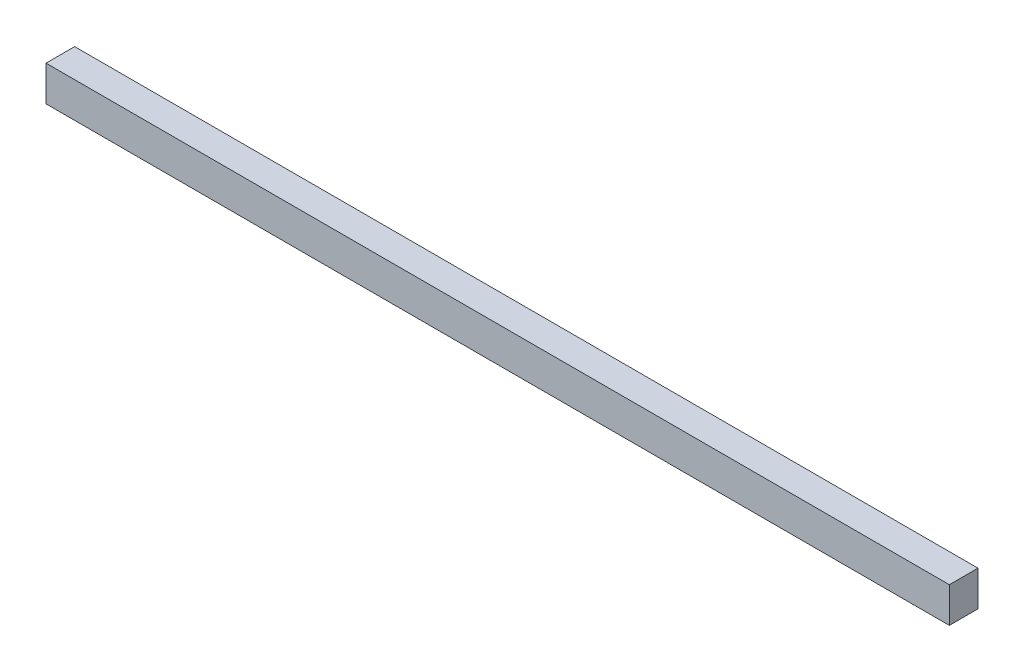
from build123d import *

# Parameters (mm, degrees)
SKETCH1_W           = 410
SKETCH1_H           = 16
BOSS_EXTRUDE1_DEPTH = 13


with BuildPart() as part:
    # Sketch1 → Boss-Extrude1 (new body)
    with BuildSketch(Plane.XY):
        Rectangle(SKETCH1_W, SKETCH1_H)
    extrude(amount=-BOSS_EXTRUDE1_DEPTH)


solid = part.part
